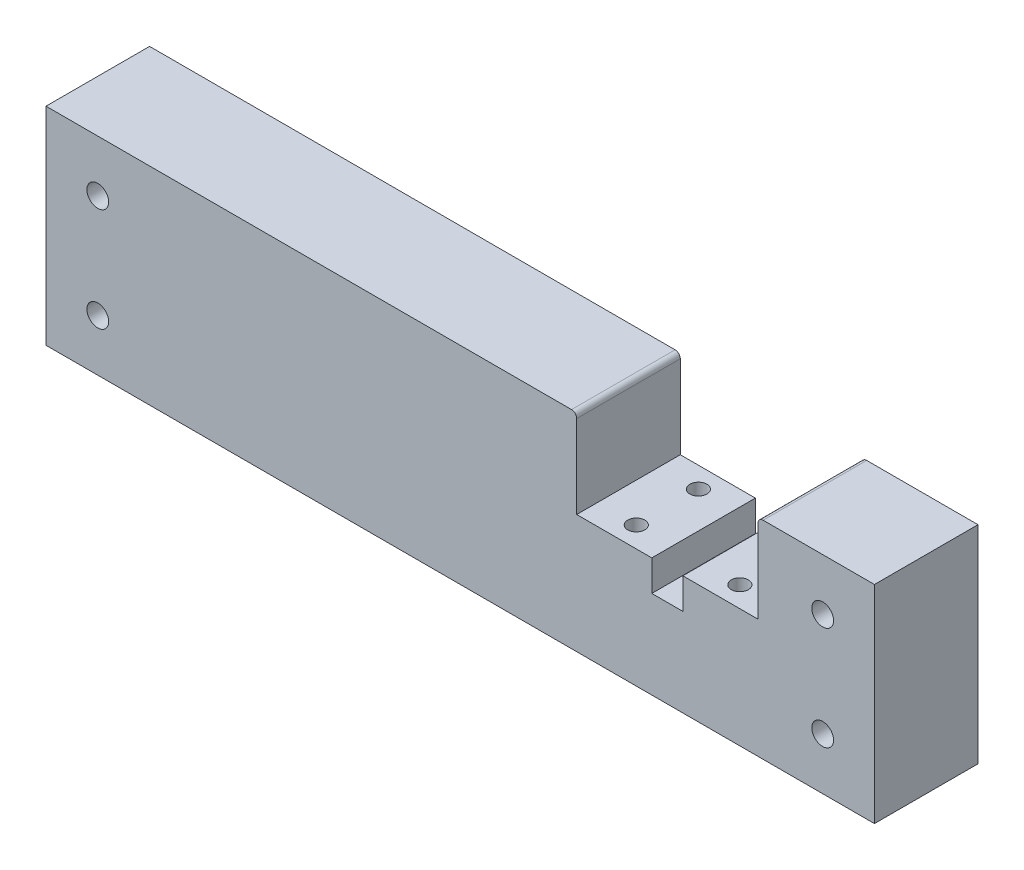
from build123d import *

# Parameters (mm, degrees)
BOSS_EXTRUDE1_DEPTH             = 20
TAP_DRILL_FOR_M4X0_7_TAP1_D     = 3.3
TAP_DRILL_FOR_M4X0_7_TAP1_DEPTH = 5
TAP_DRILL_FOR_M4X0_7_TAP1_TIP   = 0.991420021
TAP_DRILL_FOR_M5X0_8_TAP3_D     = 4.2
TAP_DRILL_FOR_M5X0_8_TAP2_D     = 4.2
TAP_DRILL_FOR_M5X0_8_TAP2_DEPTH = 7
TAP_DRILL_FOR_M5X0_8_TAP2_TIP   = 1.2618073
FILLET1_R                       = 1


with BuildPart() as part:
    # Sketch1 → Boss-Extrude1 (new body)
    with BuildSketch(Plane.XY):
        Polygon((22.5, 40), (-80, 40), (-80, 0), (80, 0), (80, 40), (57.5, 40), (57.5, 23), (57.5, 22.95), (43, 22.95), (43, 17), (37, 17), (37, 22.95), (22.5, 22.95), (22.5, 23), align=None)
    extrude(amount=-BOSS_EXTRUDE1_DEPTH)

    # Tap Drill for M4x0.7 Tap1
    with Locations(Plane(origin=(30, 22.95, -4), x_dir=(0, 0, 1), z_dir=(0, 1, 0))):
        with Locations((0, 0), (0, 20), (-12, 0), (-12, 20)):
            Hole(TAP_DRILL_FOR_M4X0_7_TAP1_D / 2, depth=TAP_DRILL_FOR_M4X0_7_TAP1_DEPTH)
            with Locations((0, 0, -(TAP_DRILL_FOR_M4X0_7_TAP1_DEPTH + TAP_DRILL_FOR_M4X0_7_TAP1_TIP / 2))):  # 118° drill point
                Cone(0, TAP_DRILL_FOR_M4X0_7_TAP1_D / 2, TAP_DRILL_FOR_M4X0_7_TAP1_TIP, mode=Mode.SUBTRACT)

    # Tap Drill for M5x0.8 Tap3 (through all)
    with Locations(Plane(origin=(-70, 30, 0), x_dir=(1, 0, 0), z_dir=(0, 0, 1))):
        with Locations((0, 0), (0, -20), (140, -20), (140, 0)):
            Hole(TAP_DRILL_FOR_M5X0_8_TAP3_D / 2)

    # Tap Drill for M5x0.8 Tap2
    with Locations(Plane(origin=(-60, 0, -10), x_dir=(-1, 0, 0), z_dir=(0, -1, 0))):
        with Locations((0, 0), (-60, 0), (-120, 0)):
            Hole(TAP_DRILL_FOR_M5X0_8_TAP2_D / 2, depth=TAP_DRILL_FOR_M5X0_8_TAP2_DEPTH)
            with Locations((0, 0, -(TAP_DRILL_FOR_M5X0_8_TAP2_DEPTH + TAP_DRILL_FOR_M5X0_8_TAP2_TIP / 2))):  # 118° drill point
                Cone(0, TAP_DRILL_FOR_M5X0_8_TAP2_D / 2, TAP_DRILL_FOR_M5X0_8_TAP2_TIP, mode=Mode.SUBTRACT)

    # Fillet1
    fillet1_edges = [part.edges().sort_by_distance(p)[0] for p in [
        (57.5, 40, -10),
        (22.5, 40, -10),
    ]]
    fillet(fillet1_edges, radius=FILLET1_R)


solid = part.part
